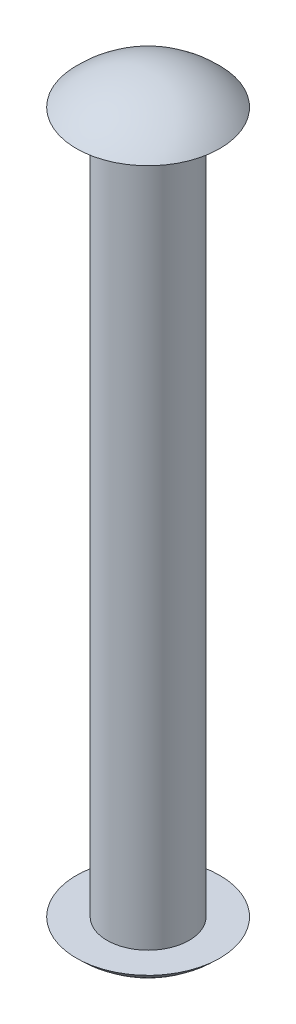
from build123d import *


with BuildPart() as part:
    # Sketch1 → Revolve1 (revolve)
    with BuildSketch(Plane.XY):
        with BuildLine():
            Line((2.54, -21.717), (2.54, 21.717))
            Line((2.54, 21.717), (4.445, 21.717))
            ThreePointArc((4.445, 21.717), (2.418007961, 23.125685243), (0, 23.622))
            Line((0, 23.622), (0, -23.622))
            ThreePointArc((0, -23.622), (2.418007961, -23.125685243), (4.445, -21.717))
            Line((4.445, -21.717), (2.54, -21.717))
        make_face()
    revolve(axis=Axis((0, 0, 0), (0, 1, 0)))


solid = part.part
